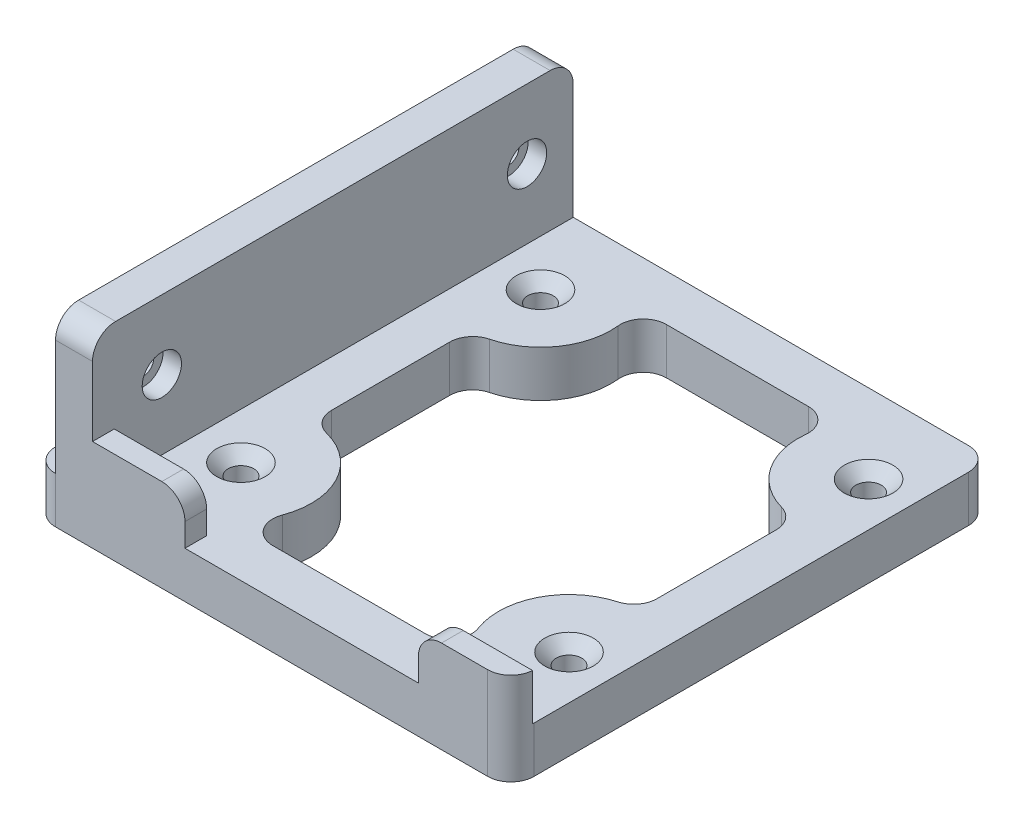
from build123d import *

# Parameters (mm, degrees)
EXTRUDE_1_DEPTH      = 54.5
EXTRUDE_1_DEPTH_BACK = 49.5
SKETCH_4_R           = 2.25
CUT_EXTRUDE_1_DEPTH  = 111.354474309
SKETCH_5_R           = 4.25
CUT_EXTRUDE_2_DEPTH  = 4
SKETCH_6_R           = 2.75
CUT_EXTRUDE_3_DEPTH  = 89.184465752
CHAMFER_1_SIZE       = 2.5
CUT_EXTRUDE_4_DEPTH  = 89.184465752
SKETCH_10_W          = 20
SKETCH_10_H          = 4.7
EXTRUDE_2_DEPTH      = 10
FILLET_1_R           = 5


with BuildPart() as part:
    # ｽｹｯﾁ3 → ﾎﾞｽ - 押し出し1 (new, two sides: drawn at the far end of the back side and taken through both)
    with BuildSketch(Plane.XY.offset(-EXTRUDE_1_DEPTH_BACK)):
        Polygon((-57.5, 8.1), (-49.5, 8.1), (-49.5, -21.9), (41, -21.9), (41, -31.9), (-62.5, -31.9), (-62.5, -21.9), (-57.5, -21.9), align=None)
    extrude(amount=EXTRUDE_1_DEPTH + EXTRUDE_1_DEPTH_BACK)

    # ｽｹｯﾁ4 → ｶｯﾄ - 押し出し1 (cut, through all)
    with BuildSketch(Plane(origin=(-49.5, 0, 0), x_dir=(0, 0, -1), z_dir=(1, 0, 0))):
        with Locations(Location((-39.5, -6.9, 0), (0, 0, 90))):
            Circle(SKETCH_4_R)
        with Locations(Location((39.5, -6.9, 0), (0, 0, 90))):
            Circle(SKETCH_4_R)
    extrude(amount=-CUT_EXTRUDE_1_DEPTH, mode=Mode.SUBTRACT)

    # ｽｹｯﾁ5 → ｶｯﾄ - 押し出し2 (cut)
    with BuildSketch(Plane(origin=(-49.5, 0, 0), x_dir=(0, 0, -1), z_dir=(1, 0, 0))):
        with Locations(Location((-39.5, -6.9, 0), (0, 0, 90))):
            Circle(SKETCH_5_R)
        with Locations(Location((39.5, -6.9, 0), (0, 0, 90))):
            Circle(SKETCH_5_R)
    extrude(amount=-CUT_EXTRUDE_2_DEPTH, mode=Mode.SUBTRACT)

    # ｽｹｯﾁ6 → ｶｯﾄ - 押し出し3 (cut, through all)
    with BuildSketch(Plane(origin=(0, -21.9, 0), x_dir=(1, 0, 0), z_dir=(0, 1, 0))):
        with Locations(Location((-39.485, 32.4, 0), (0, 0, 270))):
            Circle(SKETCH_6_R)
        with Locations(Location((31.485, 32.4, 0), (0, 0, 270))):
            Circle(SKETCH_6_R)
        with Locations(Location((31.485, -32.4, 0), (0, 0, 270))):
            Circle(SKETCH_6_R)
        with Locations(Location((-39.485, -32.4, 0), (0, 0, 270))):
            Circle(SKETCH_6_R)
    extrude(amount=-CUT_EXTRUDE_3_DEPTH, mode=Mode.SUBTRACT)

    # 面取り1
    chamfer_1_edges = [part.edges().sort_by_distance(p)[0] for p in [
        (-39.485, -21.9, -35.15),
        (31.485, -21.9, -35.15),
        (31.485, -21.9, 29.65),
        (-39.485, -21.9, 29.65),
    ]]
    chamfer(chamfer_1_edges, length=CHAMFER_1_SIZE)

    # ｽｹｯﾁ7 → ｶｯﾄ - 押し出し4 (cut, through all)
    with BuildSketch(Plane(origin=(0, -21.9, 0), x_dir=(1, 0, 0), z_dir=(0, 1, 0))):
        with BuildLine():
            ThreePointArc((22.203162897, -44.5), (16.96784035, -27.729392364), (31, -17.157714246))
            Line((31, -17.157714246), (31, 17.157714246))
            ThreePointArc((31, 17.157714246), (18.30682719, 24.725479729), (17.988611594, 39.5))
            Line((17.988611594, 39.5), (-25.988611594, 39.5))
            ThreePointArc((-25.988611594, 39.5), (-24.679892382, 36.056677236), (-24.235, 32.4))
            ThreePointArc((-24.235, 32.4), (-28.706926192, 21.611319589), (-39.5, 17.150007377))
            Line((-39.5, 17.150007377), (-39.5, -17.150007377))
            ThreePointArc((-39.5, -17.150007377), (-28.706926192, -21.611319589), (-24.235, -32.4))
            ThreePointArc((-24.235, -32.4), (-25.808185389, -39.14590558), (-30.203162897, -44.5))
            Line((-30.203162897, -44.5), (22.203162897, -44.5))
        make_face()
    extrude(amount=-CUT_EXTRUDE_4_DEPTH, mode=Mode.SUBTRACT)

    # ｽｹｯﾁ10 → ﾎﾞｽ - 押し出し2 (add)
    with BuildSketch(Plane(origin=(0, -21.9, 0), x_dir=(1, 0, 0), z_dir=(0, 1, 0))):
        with Locations((-39.5, -52.15)):
            Rectangle(SKETCH_10_W, SKETCH_10_H)
        with Locations((31, -52.15)):
            Rectangle(SKETCH_10_W, SKETCH_10_H)
    extrude(amount=EXTRUDE_2_DEPTH)

    # ﾌｨﾚｯﾄ1
    fillet_1_edges = [part.edges().sort_by_distance(p)[0] for p in [
        (-62.5, -26.9, -49.5),
        (31, -26.9, 17.157714246),
        (22.203162897, -26.9, 44.5),
        (-30.203162897, -26.9, 44.5),
        (-39.5, -26.9, 17.150007377),
        (-39.5, -26.9, -17.150007377),
        (-25.988611594, -26.9, -39.5),
        (17.988611594, -26.9, -39.5),
        (31, -26.9, -17.157714246),
        (-29.5, -11.9, 52.15),
        (21, -11.9, 52.15),
        (41, -26.9, -49.5),
        (-62.5, -26.9, 54.5),
        (41, -21.9, 54.5),
        (-53.5, 8.1, 54.5),
        (-53.5, 8.1, -49.5),
    ]]
    fillet(fillet_1_edges, radius=FILLET_1_R)


solid = part.part
